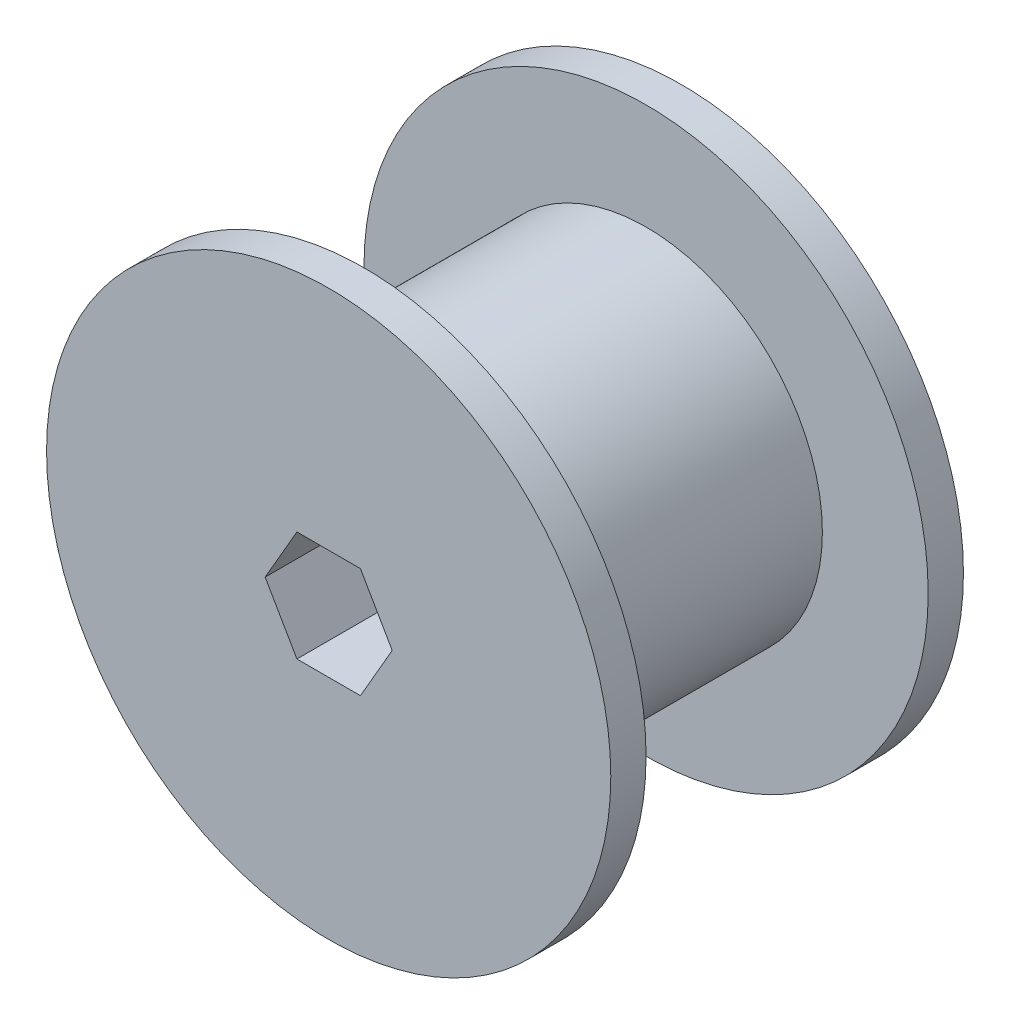
from build123d import *

# Parameters (mm, degrees)
SKETCH1_R        = 15.875
DRUM_DEPTH       = 12.7
SKETCH3_R        = 25.4
FLANGE_DEPTH     = 3.175
ATTACHMENT_DEPTH = 48.941448664


with BuildPart() as part:
    # Sketch1 → Drum (new, symmetric)
    with BuildSketch(Plane.XY):
        Circle(SKETCH1_R)
    extrude(amount=DRUM_DEPTH, both=True)

    # Sketch3 → Flange (add)
    with BuildSketch(Plane.XY.offset(12.7)):
        Circle(SKETCH3_R)
    flange = extrude(amount=FLANGE_DEPTH)

    # Flange2: Flange across plane
    add(flange.mirror(Plane.XY))

    # Sketch4 → Attachment (cut, through all)
    with BuildSketch(Plane.XY.offset(15.875)):
        Polygon((5.719231767, 0), (2.859615883, 4.953), (-2.859615883, 4.953), (-5.719231767, 0), (-2.859615883, -4.953), (2.859615883, -4.953), align=None)
    extrude(amount=-ATTACHMENT_DEPTH, mode=Mode.SUBTRACT)


solid = part.part
